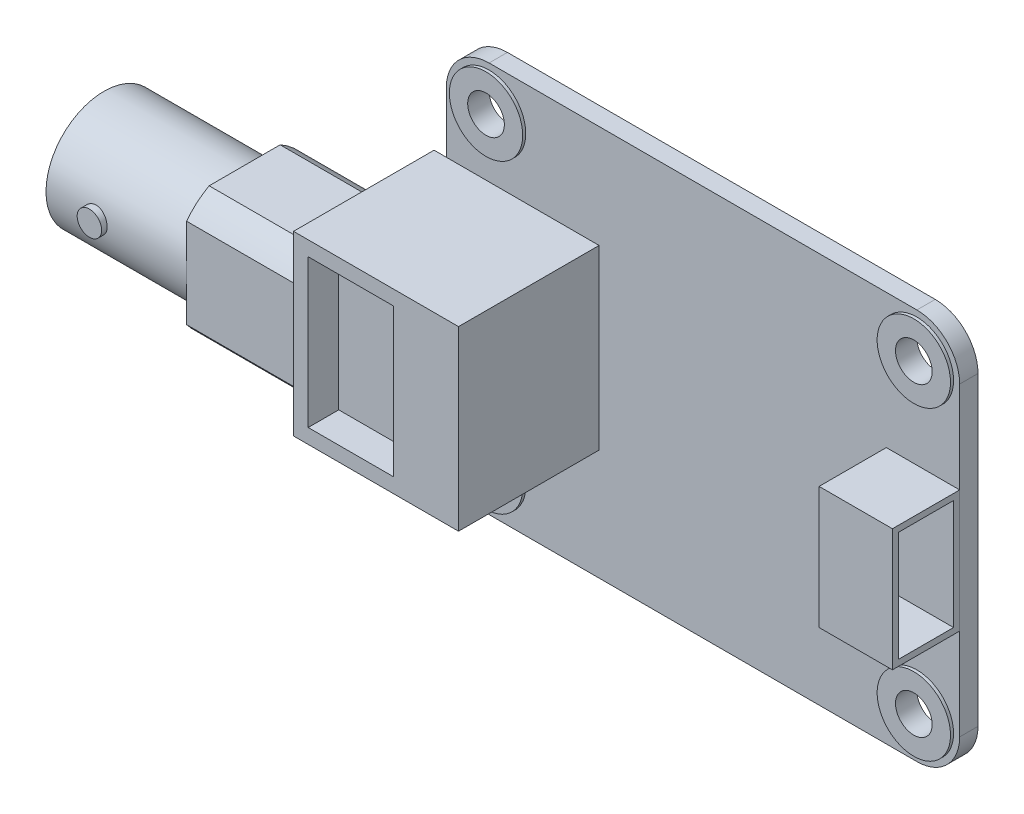
from build123d import *

# Parameters (mm, degrees)
ESQUISSE1_R             = 1.5
BOSS_EXTRU_1_DEPTH      = 1.5
ESQUISSE2_R             = 3
ESQUISSE2_R_2           = 1.5
BOSS_EXTRU_2_DEPTH      = 0.25
ESQUISSE4_W             = 13.5
ESQUISSE4_H             = 14.5
BOSS_EXTRU_3_DEPTH      = 11.5
ESQUISSE5_W             = 7
ESQUISSE5_H             = 12.1
ENL_V_MAT_EXTRU_1_DEPTH = 2.5
ESQUISSE6_R             = 6
BOSS_EXTRU_4_DEPTH      = 9
ESQUISSE7_R             = 4.75
ESQUISSE7_R_2           = 4.15
BOSS_EXTRU_5_DEPTH      = 11.5
ESQUISSE8_OUTSIDE_W     = 30.494
ESQUISSE8_OUTSIDE_H     = 48.494
ESQUISSE8_OUTSIDE_W_2   = 10.966230641
ESQUISSE8_OUTSIDE_H_2   = 10.5
ENL_V_MAT_EXTRU_2_DEPTH = 9
ESQUISSE9_R             = 1
BOSS_EXTRU_6_DEPTH      = 1
BOSS_EXTRU_7_START      = -10.5
ESQUISSE9_2_R           = 1
BOSS_EXTRU_7_DEPTH      = 1
ESQUISSE10_R            = 2
ESQUISSE10_R_2          = 0.75
BOSS_EXTRU_8_DEPTH      = 9
ESQUISSE11_W            = 6
ESQUISSE11_H            = 10
BOSS_EXTRU_9_DEPTH      = 5.5
COQUE1_T                = -0.5


with BuildPart() as part:
    # Esquisse1 → Boss.-Extru.1 (new body)
    with BuildSketch(Plane.XY):
        with BuildLine():
            ThreePointArc((-21, 12.5), (-19.974873734, 14.974873734), (-17.5, 16))
            Line((-17.5, 16), (17.5, 16))
            ThreePointArc((17.5, 16), (19.974873734, 14.974873734), (21, 12.5))
            Line((21, 12.5), (21, -12.5))
            ThreePointArc((21, -12.5), (19.974873734, -14.974873734), (17.5, -16))
            Line((17.5, -16), (-17.5, -16))
            ThreePointArc((-17.5, -16), (-19.974873734, -14.974873734), (-21, -12.5))
            Line((-21, -12.5), (-21, 12.5))
        make_face()
        with Locations((17.5, -12.5)):
            Circle(ESQUISSE1_R, mode=Mode.SUBTRACT)
        with Locations((17.5, 12.5)):
            Circle(ESQUISSE1_R, mode=Mode.SUBTRACT)
        with Locations((-17.5, -12.5)):
            Circle(ESQUISSE1_R, mode=Mode.SUBTRACT)
        with Locations((-17.5, 12.5)):
            Circle(ESQUISSE1_R, mode=Mode.SUBTRACT)
    extrude(amount=BOSS_EXTRU_1_DEPTH)

    # Esquisse2 → Boss.-Extru.2 (add)
    # profile 1 of 4: a face of its own
    with BuildSketch(Plane.XY.offset(1.5)):
        with Locations((17.5, 12.5)):
            Circle(ESQUISSE2_R)
        with Locations((17.5, 12.5)):
            Circle(ESQUISSE2_R_2, mode=Mode.SUBTRACT)
    # profile 2 of 4: a face of its own
    with BuildSketch(Plane.XY.offset(1.5)):
        with Locations((-17.5, 12.5)):
            Circle(ESQUISSE2_R)
        with Locations((-17.5, 12.5)):
            Circle(ESQUISSE2_R_2, mode=Mode.SUBTRACT)
    # profile 3 of 4: a face of its own
    with BuildSketch(Plane.XY.offset(1.5)):
        with Locations((-17.5, -12.5)):
            Circle(ESQUISSE2_R)
        with Locations((-17.5, -12.5)):
            Circle(ESQUISSE2_R_2, mode=Mode.SUBTRACT)
    # profile 4 of 4: a face of its own
    with BuildSketch(Plane.XY.offset(1.5)):
        with Locations((17.5, -12.5)):
            Circle(ESQUISSE2_R)
        with Locations((17.5, -12.5)):
            Circle(ESQUISSE2_R_2, mode=Mode.SUBTRACT)
    extrude(amount=BOSS_EXTRU_2_DEPTH)


with BuildPart() as body_2:
    # Esquisse4 → Boss.-Extru.3 (new body)
    with BuildSketch(Plane.XY.offset(1.5)):
        with Locations((-15.25, 0.32202456)):
            Rectangle(ESQUISSE4_W, ESQUISSE4_H)
    extrude(amount=BOSS_EXTRU_3_DEPTH)

    # Esquisse5 → Enlèv. mat.-Extru.1 (cut)
    with BuildSketch(Plane.XY.offset(13)):
        with Locations((-17.3, 0.32202456)):
            Rectangle(ESQUISSE5_W, ESQUISSE5_H)
    extrude(amount=-ENL_V_MAT_EXTRU_1_DEPTH, mode=Mode.SUBTRACT)

    # Esquisse6 → Boss.-Extru.4 (add)
    with BuildSketch(Plane.ZY.offset(22)):
        with Locations(Location((8, 0, 0), (0, 0, 326.442690238))):
            Circle(ESQUISSE6_R)
    extrude(amount=BOSS_EXTRU_4_DEPTH)

    # Esquisse7 → Boss.-Extru.5 (add)
    with BuildSketch(Plane.ZY.offset(31)):
        with Locations((8, 0)):
            Circle(ESQUISSE7_R)
        with Locations((8, 0)):
            Circle(ESQUISSE7_R_2, mode=Mode.SUBTRACT)
    extrude(amount=BOSS_EXTRU_5_DEPTH)

    # Esquisse8 outside → Enlèv. mat.-Extru.2 (cut)
    with BuildSketch(Plane.ZY.offset(31)):
        with Locations((7, 0)):
            Rectangle(ESQUISSE8_OUTSIDE_W, ESQUISSE8_OUTSIDE_H)
        with Locations((7.26688468, 0)):
            Rectangle(ESQUISSE8_OUTSIDE_W_2, ESQUISSE8_OUTSIDE_H_2, mode=Mode.SUBTRACT)
    extrude(amount=-ENL_V_MAT_EXTRU_2_DEPTH, mode=Mode.SUBTRACT)

    # Esquisse9 → Boss.-Extru.6 (add)
    with BuildSketch(Plane.XY.offset(13.2)):
        with Locations((-38.5, 0)):
            Circle(ESQUISSE9_R)
    extrude(amount=-BOSS_EXTRU_6_DEPTH)

    # Esquisse9<2> → Boss.-Extru.7 (add)
    with BuildSketch(Plane.XY.offset(13.2).offset(BOSS_EXTRU_7_START)):
        with Locations((-38.5, 0)):
            Circle(ESQUISSE9_2_R)
    extrude(amount=BOSS_EXTRU_7_DEPTH)

    # Esquisse10 → Boss.-Extru.8 (add)
    with BuildSketch(Plane.ZY.offset(31)):
        with Locations((8, 0)):
            Circle(ESQUISSE10_R)
        with Locations((8, 0)):
            Circle(ESQUISSE10_R_2, mode=Mode.SUBTRACT)
    extrude(amount=BOSS_EXTRU_8_DEPTH)


with BuildPart() as body_3:
    # Esquisse11 → Boss.-Extru.9 (new body)
    with BuildSketch(Plane.XY.offset(1.5)):
        with Locations((18, 0)):
            Rectangle(ESQUISSE11_W, ESQUISSE11_H)
    extrude(amount=BOSS_EXTRU_9_DEPTH)

    # Coque1
    coque1_openings = [body_3.faces().sort_by_distance(p)[0] for p in [
        (21, 0, 4.25),
    ]]
    offset(amount=COQUE1_T, openings=coque1_openings, kind=Kind.INTERSECTION)


solid = Compound([part.part, body_2.part, body_3.part])
